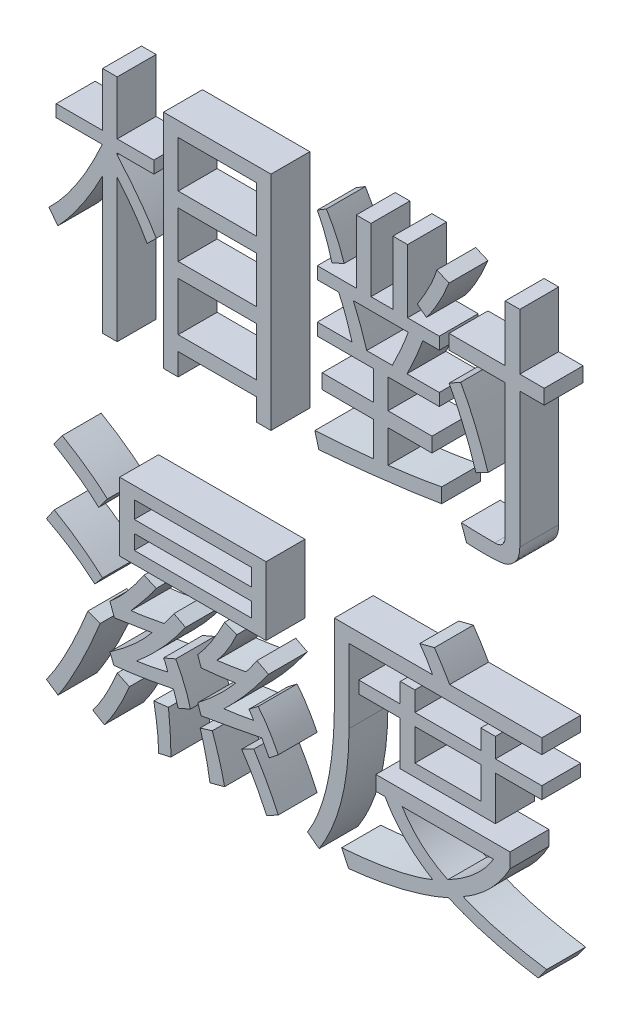
from build123d import *

# Parameters (mm, degrees)
EXTRUDE_1_DEPTH    = 3.5
SKETCH_2_W         = 7.024390244
SKETCH_2_H         = 4.170731708
SKETCH_2_H_2       = 4.390243903
EXTRUDE_1_2_DEPTH  = 3.5
EXTRUDE_1_3_DEPTH  = 3.5
EXTRUDE_1_4_DEPTH  = 3.5
EXTRUDE_1_5_DEPTH  = 3.5
EXTRUDE_1_6_DEPTH  = 3.5
EXTRUDE_1_7_DEPTH  = 3.5
EXTRUDE_1_8_DEPTH  = 3.5
SKETCH_2_W_2       = 13.170731708
SKETCH_2_H_3       = 6.146341463
SKETCH_2_W_3       = 10.536585366
SKETCH_2_H_4       = 1.536585365
SKETCH_2_H_5       = 1.317073171
EXTRUDE_1_9_DEPTH  = 3.5
EXTRUDE_1_10_DEPTH = 3.5
EXTRUDE_1_11_DEPTH = 3.5
EXTRUDE_1_12_DEPTH = 3.5
EXTRUDE_1_13_DEPTH = 3.5
EXTRUDE_1_14_DEPTH = 3.5
EXTRUDE_1_15_DEPTH = 3.5
EXTRUDE_1_16_DEPTH = 3.5
EXTRUDE_1_17_DEPTH = 3.5
EXTRUDE_1_18_DEPTH = 3.5
SKETCH_2_W_4       = 5.926829268
SKETCH_2_H_6       = 2.853658537
EXTRUDE_1_19_DEPTH = 3.5
EXTRUDE_1_20_DEPTH = 3.5


with BuildPart() as part:
    # 草圖2 → 填料-伸長1 (new body)
    with BuildSketch(Plane.XY):
        with BuildLine():
            Line((11.195121951, 8.492378049), (10.37195122, 7.682926829))
            add(Edge.make_bspline(
                [(10.37195122, 7.682926829), (10.194001007, 7.995110736), (9.828654537, 8.636050058), (9.192617307, 9.575460859), (8.478376217, 10.530055372), (7.952666495, 11.150939105), (7.682926829, 11.469512195)],
                knots=[0, 0, 0, 0, 0.926494149, 1.902168946, 2.923610835, 4, 4, 4, 4], degree=3))
            Line((7.682926829, 11.469512195), (7.682926829, -1.317073171))
            Line((7.682926829, -1.317073171), (6.365853659, -1.317073171))
            Line((6.365853659, -1.317073171), (6.365853659, 10.955030488))
            add(Edge.make_bspline(
                [(6.365853659, 10.955030488), (6.215695345, 10.664757037), (5.919445146, 10.092071011), (5.448191947, 9.262177755), (4.965376822, 8.468777478), (4.466566618, 7.714189973), (3.959301962, 6.9922869), (3.439571365, 6.306551586), (2.903589275, 5.659115278), (2.530613952, 5.250831327), (2.346036585, 5.048780488)],
                knots=[0, 0, 0, 0, 1.09419143, 2.15875114, 3.194770078, 4.203431801, 5.186928088, 6.148575884, 7.083770513, 8, 8, 8, 8], degree=3))
            Line((2.346036585, 5.048780488), (1.536585366, 6.091463415))
            add(Edge.make_bspline(
                [(1.536585366, 6.091463415), (1.759917396, 6.316467103), (2.215687975, 6.775649163), (2.861543167, 7.525851201), (3.491437342, 8.340136735), (4.094833622, 9.224938723), (4.691759287, 10.168014651), (5.261391283, 11.182375763), (5.819159698, 12.259265922), (6.165245336, 13.008121113), (6.341844512, 13.390243902)],
                knots=[0, 0, 0, 0, 0.865432811, 1.76615425, 2.700926786, 3.675112701, 4.689371464, 5.747644892, 6.850677372, 8, 8, 8, 8], degree=3))
            Line((6.341844512, 13.390243902), (2.195121951, 13.390243902))
            Line((2.195121951, 13.390243902), (2.195121951, 14.487804878))
            Line((2.195121951, 14.487804878), (6.365853659, 14.487804878))
            Line((6.365853659, 14.487804878), (6.365853659, 19.317073171))
            Line((6.365853659, 19.317073171), (7.682926829, 19.317073171))
            Line((7.682926829, 19.317073171), (7.682926829, 14.487804878))
            Line((7.682926829, 14.487804878), (10.975609756, 14.487804878))
            Line((10.975609756, 14.487804878), (10.975609756, 13.390243902))
            Line((10.975609756, 13.390243902), (7.682926829, 13.390243902))
            Line((7.682926829, 13.390243902), (7.682926829, 13.225609756))
            add(Edge.make_bspline(
                [(7.682926829, 13.225609756), (7.867915933, 13.013746523), (8.230737255, 12.598216651), (8.749747103, 11.972489826), (9.234615126, 11.358953316), (9.694165494, 10.763026288), (10.1136308, 10.175919212), (10.507113856, 9.605772744), (10.868089211, 9.048616748), (11.087786379, 8.674941418), (11.195121951, 8.492378049)],
                knots=[0, 0, 0, 0, 1.143459145, 2.242679984, 3.304712972, 4.322704541, 5.301803685, 6.237830081, 7.139071671, 8, 8, 8, 8], degree=3))
        make_face()
    extrude(amount=EXTRUDE_1_DEPTH)


with BuildPart() as body_2:
    # 草圖2 → Extrude 1 2 (new body)
    with BuildSketch(Plane.XY):
        Polygon((21.512195122, -1.317073171), (20.195121951, -1.317073171), (20.195121951, 0.658536585), (13.170731707, 0.658536585), (13.170731707, -1.317073171), (11.853658537, -1.317073171), (11.853658537, 18.658536585), (21.512195122, 18.658536585), align=None)
        with Locations((16.682926829, 15.256097561)):
            Rectangle(SKETCH_2_W, SKETCH_2_H, mode=Mode.SUBTRACT)
        with Locations((16.682926829, 9.768292683)):
            Rectangle(SKETCH_2_W, SKETCH_2_H, mode=Mode.SUBTRACT)
        with Locations((16.682926829, 4.170731708)):
            Rectangle(SKETCH_2_W, SKETCH_2_H_2, mode=Mode.SUBTRACT)
    extrude(amount=EXTRUDE_1_2_DEPTH)


with BuildPart() as body_3:
    # 草圖2 → Extrude 1 3 (new body)
    with BuildSketch(Plane.XY):
        with BuildLine():
            add(Edge.make_bspline(
                [(36.87804878, 0.658536585), (36.479239613, 0.592109643), (35.664311248, 0.456372544), (34.413150927, 0.272757679), (33.109447277, 0.098721548), (31.753467888, -0.069606956), (30.344788428, -0.230068855), (28.883781703, -0.384994037), (27.370008335, -0.529462451), (26.342700315, -0.615016395), (25.820121951, -0.658536585)],
                knots=[0, 0, 0, 0, 0.871065814, 1.779939626, 2.724368522, 3.704811522, 4.72380686, 5.778991205, 6.870201418, 8, 8, 8, 8], degree=3))
            Line((25.820121951, -0.658536585), (25.463414634, 0.658536585))
            add(Edge.make_bspline(
                [(25.463414634, 0.658536585), (25.870473505, 0.684110794), (26.706615328, 0.736642914), (27.992053677, 0.831510617), (29.340832205, 0.953832667), (30.260731458, 1.044355014), (30.731707317, 1.09070122)],
                knots=[0, 0, 0, 0, 0.92583437, 1.90176137, 2.925730468, 4, 4, 4, 4], degree=3))
            Line((30.731707317, 1.09070122), (30.731707317, 4.170731707))
            Line((30.731707317, 4.170731707), (26.12195122, 4.170731707))
            Line((26.12195122, 4.170731707), (26.12195122, 5.487804878))
            Line((26.12195122, 5.487804878), (30.731707317, 5.487804878))
            Line((30.731707317, 5.487804878), (30.731707317, 8.12195122))
            Line((30.731707317, 8.12195122), (25.682926829, 8.12195122))
            Line((25.682926829, 8.12195122), (25.682926829, 9.219512195))
            Line((25.682926829, 9.219512195), (28.81097561, 9.219512195))
            add(Edge.make_bspline(
                [(28.81097561, 9.219512195), (28.722233505, 9.522215625), (28.549049417, 10.112954568), (28.250347401, 10.962153868), (27.946901845, 11.761759944), (27.716095311, 12.266373839), (27.603658537, 12.512195122)],
                knots=[0, 0, 0, 0, 1.078020835, 2.10380467, 3.076273615, 4, 4, 4, 4], degree=3))
            Line((27.603658537, 12.512195122), (25.682926829, 12.512195122))
            Line((25.682926829, 12.512195122), (25.682926829, 13.609756098))
            Line((25.682926829, 13.609756098), (29.195121951, 13.609756098))
            Line((29.195121951, 13.609756098), (29.195121951, 19.317073171))
            Line((29.195121951, 19.317073171), (30.512195122, 19.317073171))
            Line((30.512195122, 19.317073171), (30.512195122, 13.609756098))
            Line((30.512195122, 13.609756098), (32.487804878, 13.609756098))
            Line((32.487804878, 13.609756098), (32.487804878, 19.317073171))
            Line((32.487804878, 19.317073171), (33.804878049, 19.317073171))
            Line((33.804878049, 19.317073171), (33.804878049, 13.609756098))
            Line((33.804878049, 13.609756098), (36.658536585, 13.609756098))
            Line((36.658536585, 13.609756098), (36.658536585, 12.512195122))
            Line((36.658536585, 12.512195122), (35.176829268, 12.512195122))
            add(Edge.make_bspline(
                [(35.176829268, 12.512195122), (35.072202937, 12.23256672), (34.863030097, 11.673523249), (34.518148298, 10.845603445), (34.149237498, 10.026346651), (33.883122969, 9.488545537), (33.75, 9.219512195)],
                knots=[0, 0, 0, 0, 0.997752604, 1.994744001, 2.996876897, 4, 4, 4, 4], degree=3))
            Line((33.75, 9.219512195), (36.658536585, 9.219512195))
            Line((36.658536585, 9.219512195), (36.658536585, 8.12195122))
            Line((36.658536585, 8.12195122), (32.048780488, 8.12195122))
            Line((32.048780488, 8.12195122), (32.048780488, 5.487804878))
            Line((32.048780488, 5.487804878), (36, 5.487804878))
            Line((36, 5.487804878), (36, 4.170731707))
            Line((36, 4.170731707), (32.048780488, 4.170731707))
            Line((32.048780488, 4.170731707), (32.048780488, 1.245045732))
            add(Edge.make_bspline(
                [(32.048780488, 1.245045732), (32.433165458, 1.288913096), (33.215646696, 1.378212605), (34.404286369, 1.549722353), (35.631027102, 1.742115455), (36.457681907, 1.896899601), (36.87804878, 1.975609756)],
                knots=[0, 0, 0, 0, 0.950226922, 1.934349145, 2.949584292, 4, 4, 4, 4], degree=3))
            Line((36.87804878, 1.975609756), (36.87804878, 0.658536585))
        make_face()
        with BuildLine():
            Line((33.859756098, 12.512195122), (28.920731707, 12.512195122))
            add(Edge.make_bspline(
                [(28.920731707, 12.512195122), (29.028453625, 12.258959869), (29.247963514, 11.742930785), (29.557869177, 10.940732841), (29.850643317, 10.095390577), (30.034489589, 9.514915436), (30.12804878, 9.219512195)],
                knots=[0, 0, 0, 0, 0.941091742, 1.917705787, 2.940322478, 4, 4, 4, 4], degree=3))
            Line((30.12804878, 9.219512195), (32.432926829, 9.219512195))
            add(Edge.make_bspline(
                [(32.432926829, 9.219512195), (32.584264269, 9.52974749), (32.873128727, 10.121907307), (33.262226073, 10.981368871), (33.590573188, 11.767604059), (33.773533973, 12.273694753), (33.859756098, 12.512195122)],
                knots=[0, 0, 0, 0, 1.153513399, 2.201762002, 3.152562119, 4, 4, 4, 4], degree=3))
        make_face(mode=Mode.SUBTRACT)
    extrude(amount=EXTRUDE_1_3_DEPTH)


with BuildPart() as body_4:
    # 草圖2 → Extrude 1 4 (new body)
    with BuildSketch(Plane.XY):
        with BuildLine():
            Line((46.097560976, 12.951219512), (43.902439024, 12.951219512))
            Line((43.902439024, 12.951219512), (43.902439024, 0.795731707))
            add(Edge.make_bspline(
                [(43.902439024, 0.795731707), (43.89874847, 0.663798036), (43.891715468, 0.412375126), (43.813850742, 0.057097246), (43.692685574, -0.257432277), (43.516873076, -0.522584136), (43.315622187, -0.744710865), (43.096501316, -0.924349749), (42.868006095, -1.069918931), (42.658115071, -1.154666328), (42.470236451, -1.204835945), (42.298050304, -1.234793709), (42.093866371, -1.256397329), (41.858680139, -1.282303045), (41.590878487, -1.298316512), (41.291212997, -1.307597972), (40.959633148, -1.314612526), (40.727518967, -1.31622911), (40.60632622, -1.317073171)],
                knots=[0, 0, 0, 0, 1.393959343, 2.656435708, 3.829226923, 4.940030392, 6.002126219, 6.990473935, 7.930543058, 8.858465568, 9.372067435, 9.986739113, 10.705586259, 11.54470175, 12.490360102, 13.543598056, 14.717449747, 16, 16, 16, 16], degree=3))
            add(Edge.make_bspline(
                [(40.60632622, -1.317073171), (40.346680538, -1.315475135), (39.846411552, -1.312396141), (39.347459424, -1.276183219), (39.107469512, -1.258765244)],
                knots=[0, 0, 0, 0, 1.038024297, 2, 2, 2, 2], degree=3))
            Line((39.107469512, -1.258765244), (38.634146341, 0.068597561))
            add(Edge.make_bspline(
                [(38.634146341, 0.068597561), (38.846761388, 0.057371155), (39.29696043, 0.033599945), (40.011742263, 0.015883439), (40.801762821, 0.000619343), (41.354029714, 0.000212337), (41.64214939, 0)],
                knots=[0, 0, 0, 0, 0.849009304, 1.797724023, 2.851064495, 4, 4, 4, 4], degree=3))
            add(Edge.make_bspline(
                [(41.64214939, 0), (41.715719876, 0.001550386), (41.855516521, 0.004496388), (42.049685822, 0.055650379), (42.220232086, 0.127261484), (42.353482251, 0.243273481), (42.459665489, 0.384276048), (42.535865329, 0.557498863), (42.579177844, 0.761595121), (42.583232144, 0.907557455), (42.585365854, 0.984375)],
                knots=[0, 0, 0, 0, 1.126045964, 2.139682047, 3.066887442, 3.939260296, 4.817270513, 5.760467651, 6.821371433, 8, 8, 8, 8], degree=3))
            Line((42.585365854, 0.984375), (42.585365854, 12.951219512))
            Line((42.585365854, 12.951219512), (37.536585366, 12.951219512))
            Line((37.536585366, 12.951219512), (37.536585366, 14.268292683))
            Line((37.536585366, 14.268292683), (42.585365854, 14.268292683))
            Line((42.585365854, 14.268292683), (42.585365854, 19.317073171))
            Line((42.585365854, 19.317073171), (43.902439024, 19.317073171))
            Line((43.902439024, 19.317073171), (43.902439024, 14.268292683))
            Line((43.902439024, 14.268292683), (46.097560976, 14.268292683))
            Line((46.097560976, 14.268292683), (46.097560976, 12.951219512))
        make_face()
    extrude(amount=EXTRUDE_1_4_DEPTH)


with BuildPart() as body_5:
    # 草圖2 → Extrude 1 5 (new body)
    with BuildSketch(Plane.XY):
        with BuildLine():
            add(Edge.make_bspline(
                [(37.536585366, 18.181783537), (37.393225684, 17.841483376), (37.111468153, 17.172661207), (36.624266309, 16.216216026), (36.097284623, 15.318753538), (35.701054348, 14.761828266), (35.506097561, 14.487804878)],
                knots=[0, 0, 0, 0, 1.048181086, 2.060083505, 3.045504817, 4, 4, 4, 4], degree=3))
            Line((35.506097561, 14.487804878), (34.682926829, 15.115472561))
            add(Edge.make_bspline(
                [(34.682926829, 15.115472561), (34.790381826, 15.285131256), (34.999827137, 15.615820563), (35.286869763, 16.110202132), (35.546893211, 16.584587488), (35.786635769, 17.034315201), (35.987126618, 17.469388445), (36.167523279, 17.88093305), (36.320356596, 18.273769925), (36.400440084, 18.533431415), (36.43902439, 18.658536585)],
                knots=[0, 0, 0, 0, 1.215130635, 2.368465142, 3.458389289, 4.488834968, 5.451365271, 6.356147849, 7.20799036, 8, 8, 8, 8], degree=3))
            Line((36.43902439, 18.658536585), (37.536585366, 18.181783537))
        make_face()
    extrude(amount=EXTRUDE_1_5_DEPTH)


with BuildPart() as body_6:
    # 草圖2 → Extrude 1 6 (new body)
    with BuildSketch(Plane.XY):
        with BuildLine():
            Line((28.097560976, 14.985137195), (27, 14.487804878))
            add(Edge.make_bspline(
                [(27, 14.487804878), (26.917764724, 14.788419731), (26.753744958, 15.388001574), (26.446077837, 16.264685579), (26.094883421, 17.119219593), (25.820136532, 17.66775252), (25.682926829, 17.941692073)],
                knots=[0, 0, 0, 0, 1.009354514, 2.013176112, 3.007772146, 4, 4, 4, 4], degree=3))
            Line((25.682926829, 17.941692073), (26.506097561, 18.43902439))
            add(Edge.make_bspline(
                [(26.506097561, 18.43902439), (26.66597493, 18.169879825), (26.987265848, 17.629004623), (27.412106667, 16.780899391), (27.783062226, 15.89720013), (27.992270199, 15.29048599), (28.097560976, 14.985137195)],
                knots=[0, 0, 0, 0, 0.985279188, 1.980025419, 2.983381524, 4, 4, 4, 4], degree=3))
        make_face()
    extrude(amount=EXTRUDE_1_6_DEPTH)


with BuildPart() as body_7:
    # 草圖2 → Extrude 1 7 (new body)
    with BuildSketch(Plane.XY):
        with BuildLine():
            Line((41.048780488, 5.179115854), (39.951219512, 4.609756098))
            add(Edge.make_bspline(
                [(39.951219512, 4.609756098), (39.799297043, 5.094275082), (39.49277485, 6.071851493), (38.920236977, 7.514672907), (38.282417195, 8.962844479), (37.786865716, 9.905931038), (37.536585366, 10.382240854)],
                knots=[0, 0, 0, 0, 0.971873337, 1.960873523, 2.970130635, 4, 4, 4, 4], degree=3))
            Line((37.536585366, 10.382240854), (38.579268293, 10.975609756))
            add(Edge.make_bspline(
                [(38.579268293, 10.975609756), (38.686623969, 10.781809619), (38.907212814, 10.383599204), (39.226462107, 9.760176378), (39.535346156, 9.093066827), (39.851476299, 8.390140547), (40.151182545, 7.642392048), (40.461226187, 6.859530137), (40.756023754, 6.032828235), (40.949912666, 5.467425818), (41.048780488, 5.179115854)],
                knots=[0, 0, 0, 0, 0.842606769, 1.73134444, 2.663122562, 3.638416779, 4.662315381, 5.726598791, 6.840747397, 8, 8, 8, 8], degree=3))
        make_face()
    extrude(amount=EXTRUDE_1_7_DEPTH)


with BuildPart() as body_8:
    # 草圖2 → Extrude 1 8 (new body)
    with BuildSketch(Plane.XY):
        with BuildLine():
            Line((6.804878049, -14.006097561), (6.016006098, -15.048780488))
            add(Edge.make_bspline(
                [(6.016006098, -15.048780488), (5.895685002, -14.936910658), (5.645839613, -14.704614225), (5.240864995, -14.363749041), (4.796502529, -14.013374166), (4.313142114, -13.651959296), (3.784045473, -13.287983824), (3.219093738, -12.910187991), (2.613155357, -12.524526019), (2.192245081, -12.270821356), (1.975609756, -12.140243902)],
                knots=[0, 0, 0, 0, 0.790397559, 1.641251557, 2.545903749, 3.512977392, 4.544534932, 5.635403711, 6.782982706, 8, 8, 8, 8], degree=3))
            Line((1.975609756, -12.140243902), (2.740472561, -11.097560976))
            add(Edge.make_bspline(
                [(2.740472561, -11.097560976), (3.131847794, -11.331200457), (3.891441595, -11.784655571), (4.954330216, -12.513844259), (5.928662336, -13.23811268), (6.518751932, -13.75531396), (6.804878049, -14.006097561)],
                knots=[0, 0, 0, 0, 1.09226414, 2.11990182, 3.088366926, 4, 4, 4, 4], degree=3))
        make_face()
    extrude(amount=EXTRUDE_1_8_DEPTH)


with BuildPart() as body_9:
    # 草圖2 → Extrude 1 9 (new body)
    with BuildSketch(Plane.XY):
        with Locations((14.487804878, -14.829268293)):
            Rectangle(SKETCH_2_W_2, SKETCH_2_H_3)
        with Locations((14.487804878, -13.62195122)):
            Rectangle(SKETCH_2_W_3, SKETCH_2_H_4, mode=Mode.SUBTRACT)
        with Locations((14.487804878, -16.146341464)):
            Rectangle(SKETCH_2_W_3, SKETCH_2_H_5, mode=Mode.SUBTRACT)
    extrude(amount=EXTRUDE_1_9_DEPTH)


with BuildPart() as body_10:
    # 草圖2 → Extrude 1 10 (new body)
    with BuildSketch(Plane.XY):
        with BuildLine():
            Line((6.365853659, -20.37195122), (5.669588415, -21.195121951))
            add(Edge.make_bspline(
                [(5.669588415, -21.195121951), (5.34266575, -20.921971199), (4.683540255, -20.371258002), (3.622555842, -19.621086691), (2.502574085, -18.914688921), (1.715503577, -18.497682254), (1.317073171, -18.286585366)],
                knots=[0, 0, 0, 0, 0.973940654, 1.963611541, 2.969140539, 4, 4, 4, 4], degree=3))
            Line((1.317073171, -18.286585366), (2.023628049, -17.243902439))
            add(Edge.make_bspline(
                [(2.023628049, -17.243902439), (2.410462708, -17.472874497), (3.181893601, -17.929493663), (4.28872953, -18.689142947), (5.356685602, -19.495819145), (6.029494972, -20.079933818), (6.365853659, -20.37195122)],
                knots=[0, 0, 0, 0, 1.005963703, 2.006106376, 3.003189505, 4, 4, 4, 4], degree=3))
        make_face()
    extrude(amount=EXTRUDE_1_10_DEPTH)


with BuildPart() as body_11:
    # 草圖2 → Extrude 1 11 (new body)
    with BuildSketch(Plane.XY):
        with BuildLine():
            Line((14.268292683, -26.645198171), (13.170731707, -27.12195122))
            add(Edge.make_bspline(
                [(13.170731707, -27.12195122), (13.130175931, -26.986851776), (13.054378028, -26.734353728), (12.939942123, -26.38525642), (12.842780112, -26.089017729), (12.775703918, -25.912151551), (12.745426829, -25.832317073)],
                knots=[0, 0, 0, 0, 1.246138474, 2.329006878, 3.245741243, 4, 4, 4, 4], degree=3))
            add(Edge.make_bspline(
                [(12.745426829, -25.832317073), (12.289780384, -25.925467503), (11.386429348, -26.110144763), (10.034523774, -26.335028498), (8.703276932, -26.536368529), (7.819350368, -26.634348257), (7.381097561, -26.682926829)],
                knots=[0, 0, 0, 0, 1.027005234, 2.036109911, 3.026298815, 4, 4, 4, 4], degree=3))
            Line((7.381097561, -26.682926829), (7.024390244, -25.804878049))
            add(Edge.make_bspline(
                [(7.024390244, -25.804878049), (7.223226392, -25.665689168), (7.613907099, -25.392205644), (8.170650634, -24.965535427), (8.698556491, -24.543428761), (9.191350708, -24.119939771), (9.648737467, -23.693937638), (10.070676626, -23.267068993), (10.46399082, -22.845044627), (10.70162726, -22.55240456), (10.817835366, -22.40929878)],
                knots=[0, 0, 0, 0, 1.140042612, 2.239998397, 3.294336047, 4.314948586, 5.291554596, 6.229593053, 7.134242047, 8, 8, 8, 8], degree=3))
            Line((10.817835366, -22.40929878), (7.429115854, -22.951219512))
            Line((7.429115854, -22.951219512), (7.024390244, -21.853658537))
            add(Edge.make_bspline(
                [(7.024390244, -21.853658537), (7.152313597, -21.745052012), (7.414656721, -21.522323523), (7.79783094, -21.157989708), (8.180891497, -20.759640102), (8.566276423, -20.330305797), (8.948983289, -19.866741708), (9.334215912, -19.372162714), (9.718438798, -18.842790687), (9.969310834, -18.474739516), (10.097560976, -18.286585366)],
                knots=[0, 0, 0, 0, 0.852319151, 1.74792221, 2.684397488, 3.659152232, 4.677899211, 5.737400043, 6.843319611, 8, 8, 8, 8], degree=3))
            Line((10.097560976, -18.286585366), (11.195121951, -18.773628049))
            add(Edge.make_bspline(
                [(11.195121951, -18.773628049), (11.159096052, -18.832302304), (11.074933034, -18.969375978), (10.913801312, -19.195690905), (10.706272595, -19.47515602), (10.446004087, -19.804440347), (10.142346905, -20.189661197), (9.783284628, -20.623586416), (9.381307352, -21.115020226), (9.090981676, -21.455201443), (8.938262195, -21.634146341)],
                knots=[0, 0, 0, 0, 0.453096944, 1.058516412, 1.827631533, 2.744419089, 3.820990896, 5.056301648, 6.451531779, 8, 8, 8, 8], degree=3))
            add(Edge.make_bspline(
                [(8.938262195, -21.634146341), (9.017181851, -21.627647173), (9.187833605, -21.613593709), (9.462494439, -21.58275179), (9.775404808, -21.536325971), (10.127633629, -21.4819738), (10.518611773, -21.416477587), (10.947298697, -21.340698056), (11.415245567, -21.255496404), (11.739420585, -21.191026189), (11.908536585, -21.157393293)],
                knots=[0, 0, 0, 0, 0.631425652, 1.365361961, 2.20340383, 3.153685227, 4.207324198, 5.364426221, 6.625070808, 8, 8, 8, 8], degree=3))
            add(Edge.make_bspline(
                [(11.908536585, -21.157393293), (11.997958516, -21.038673594), (12.167589286, -20.813465819), (12.403528526, -20.492473664), (12.607394408, -20.20683532), (12.729715531, -20.026881181), (12.786585366, -19.943216463)],
                knots=[0, 0, 0, 0, 1.19014648, 2.257672853, 3.189953014, 4, 4, 4, 4], degree=3))
            Line((12.786585366, -19.943216463), (13.829268293, -20.498856707))
            add(Edge.make_bspline(
                [(13.829268293, -20.498856707), (13.674409408, -20.718534256), (13.364576764, -21.158052312), (12.867406481, -21.794393447), (12.353846024, -22.421842479), (11.810628715, -23.029815793), (11.248344837, -23.629558301), (10.658591051, -24.210049026), (10.047660476, -24.77859228), (9.624343477, -25.142031459), (9.411585366, -25.324695122)],
                knots=[0, 0, 0, 0, 0.982953296, 1.966635754, 2.952910358, 3.948221883, 4.94812618, 5.95943845, 6.974418644, 8, 8, 8, 8], degree=3))
            add(Edge.make_bspline(
                [(9.411585366, -25.324695122), (9.56707735, -25.29957108), (9.867854461, -25.250972198), (10.302726179, -25.180234696), (10.705198944, -25.108095674), (11.073113997, -25.035951746), (11.408554335, -24.968140028), (11.708849342, -24.898800028), (11.978260513, -24.835123564), (12.14533923, -24.787887775), (12.224085366, -24.765625)],
                knots=[0, 0, 0, 0, 1.317536546, 2.54858691, 3.685391053, 4.737587821, 5.68475564, 6.547800657, 7.315561622, 8, 8, 8, 8], degree=3))
            add(Edge.make_bspline(
                [(12.224085366, -24.765625), (12.193572644, -24.671776705), (12.136336043, -24.495733499), (12.05040038, -24.249174772), (11.953115726, -24.043551291), (11.885080603, -23.920430494), (11.853658537, -23.863567073)],
                knots=[0, 0, 0, 0, 1.211754691, 2.273042671, 3.202403625, 4, 4, 4, 4], degree=3))
            Line((11.853658537, -23.863567073), (12.951219512, -23.390243902))
            add(Edge.make_bspline(
                [(12.951219512, -23.390243902), (13.091283222, -23.647802112), (13.371063731, -24.16228061), (13.718693732, -24.969343605), (14.031742022, -25.793174796), (14.189182344, -26.360253466), (14.268292683, -26.645198171)],
                knots=[0, 0, 0, 0, 0.998776884, 1.99507999, 2.992571276, 4, 4, 4, 4], degree=3))
        make_face()
    extrude(amount=EXTRUDE_1_11_DEPTH)


with BuildPart() as body_12:
    # 草圖2 → Extrude 1 12 (new body)
    with BuildSketch(Plane.XY):
        with BuildLine():
            Line((22.170731707, -26.254192073), (21.347560976, -26.902439024))
            Line((21.347560976, -26.902439024), (20.68902439, -25.674542683))
            add(Edge.make_bspline(
                [(20.68902439, -25.674542683), (20.391891489, -25.733492164), (19.817407046, -25.847466617), (18.984030877, -26.001995168), (18.212273827, -26.153099485), (17.499003518, -26.280362285), (16.846749556, -26.402352363), (16.253324972, -26.508425758), (15.719427044, -26.601212096), (15.383037243, -26.65683349), (15.225228659, -26.682926829)],
                knots=[0, 0, 0, 0, 1.308450527, 2.52979212, 3.661039907, 4.705226898, 5.659308597, 6.527258405, 7.309101332, 8, 8, 8, 8], degree=3))
            Line((15.225228659, -26.682926829), (14.937118902, -25.804878049))
            add(Edge.make_bspline(
                [(14.937118902, -25.804878049), (15.250163932, -25.559463233), (15.872295357, -25.071737013), (16.744357185, -24.275884112), (17.577173779, -23.453884345), (18.085991327, -22.866602036), (18.339557927, -22.573932927)],
                knots=[0, 0, 0, 0, 1.015027455, 2.017219306, 3.011891471, 4, 4, 4, 4], degree=3))
            add(Edge.make_bspline(
                [(18.339557927, -22.573932927), (18.244660157, -22.588752856), (18.044645104, -22.619988668), (17.729695775, -22.670088159), (17.384760833, -22.711173581), (17.011390823, -22.761843025), (16.609876899, -22.808246328), (16.178925835, -22.856929713), (15.719293016, -22.904820084), (15.402459783, -22.935424932), (15.238948171, -22.951219512)],
                knots=[0, 0, 0, 0, 0.737893124, 1.55524974, 2.449670796, 3.406192835, 4.449879139, 5.554643363, 6.737997893, 8, 8, 8, 8], degree=3))
            Line((15.238948171, -22.951219512), (14.926829268, -22.073170732))
            add(Edge.make_bspline(
                [(14.926829268, -22.073170732), (15.030768115, -21.953997888), (15.242814859, -21.710872106), (15.548947135, -21.320150888), (15.85239793, -20.899668984), (16.155779398, -20.447953065), (16.455821517, -19.965886762), (16.755355303, -19.452281573), (17.052895395, -18.909088461), (17.24413463, -18.532913097), (17.341463415, -18.341463415)],
                knots=[0, 0, 0, 0, 0.851293495, 1.736732884, 2.671307665, 3.642760826, 4.665888274, 5.727994635, 6.843691672, 8, 8, 8, 8], degree=3))
            Line((17.341463415, -18.341463415), (18.43902439, -18.766768293))
            add(Edge.make_bspline(
                [(18.43902439, -18.766768293), (18.317042263, -19.031627329), (18.075716971, -19.555615438), (17.65128078, -20.300853512), (17.182349964, -21.001475439), (16.830426883, -21.433238667), (16.655487805, -21.647865854)],
                knots=[0, 0, 0, 0, 1.028686851, 2.035119074, 3.023268221, 4, 4, 4, 4], degree=3))
            add(Edge.make_bspline(
                [(16.655487805, -21.647865854), (17.076719721, -21.592790376), (17.941955873, -21.479661971), (18.800860632, -21.325618836), (19.241615854, -21.246570122)],
                knots=[0, 0, 0, 0, 0.973680804, 2, 2, 2, 2], degree=3))
            add(Edge.make_bspline(
                [(19.241615854, -21.246570122), (19.268323945, -21.219504085), (19.327539721, -21.159494688), (19.416591566, -21.049702255), (19.522012194, -20.917304199), (19.643198491, -20.759943026), (19.77137362, -20.572646757), (19.919705186, -20.364835236), (20.081457272, -20.130799207), (20.191944943, -19.965109436), (20.25, -19.87804878)],
                knots=[0, 0, 0, 0, 0.535966828, 1.188317497, 1.991580308, 2.923535453, 3.988168681, 5.191497644, 6.524289967, 8, 8, 8, 8], degree=3))
            Line((20.25, -19.87804878), (21.292682927, -20.42339939))
            add(Edge.make_bspline(
                [(21.292682927, -20.42339939), (20.988908254, -20.842409807), (20.383566758, -21.677385251), (19.410157839, -22.876435786), (18.380771116, -24.020074506), (17.655726901, -24.743640012), (17.293445122, -25.105182927)],
                knots=[0, 0, 0, 0, 1.00706062, 2.006801875, 3.004061618, 4, 4, 4, 4], degree=3))
            add(Edge.make_bspline(
                [(17.293445122, -25.105182927), (17.529109594, -25.075362256), (17.993050519, -25.016655785), (18.674158163, -24.912194234), (19.33108237, -24.804470704), (19.758574126, -24.72094391), (19.96875, -24.679878049)],
                knots=[0, 0, 0, 0, 1.051996469, 2.071013125, 3.051615621, 4, 4, 4, 4], degree=3))
            add(Edge.make_bspline(
                [(19.96875, -24.679878049), (19.935319613, -24.630898493), (19.854677472, -24.512748016), (19.755442151, -24.353999186), (19.672859417, -24.214852233), (19.616481846, -24.127012489), (19.573349547, -24.062693126), (19.546986059, -24.028120857), (19.536585366, -24.014481707)],
                knots=[0, 0, 0, 0, 1.344806216, 3.243996286, 4.244528133, 5.014139586, 5.61106697, 6, 6, 6, 6], degree=3))
            Line((19.536585366, -24.014481707), (20.359756098, -23.390243902))
            add(Edge.make_bspline(
                [(20.359756098, -23.390243902), (20.519494917, -23.586853577), (20.851682152, -23.995716148), (21.305497849, -24.67830764), (21.754041633, -25.434697473), (22.028613184, -25.974690906), (22.170731707, -26.254192073)],
                knots=[0, 0, 0, 0, 0.894550579, 1.860275952, 2.892476588, 4, 4, 4, 4], degree=3))
        make_face()
    extrude(amount=EXTRUDE_1_12_DEPTH)


with BuildPart() as body_13:
    # 草圖2 → Extrude 1 13 (new body)
    with BuildSketch(Plane.XY):
        with BuildLine():
            add(Edge.make_bspline(
                [(6.146341463, -24.038490854), (5.995846728, -24.406145271), (5.699697497, -25.129629532), (5.236898904, -26.18366434), (4.770196084, -27.189920888), (4.300153355, -28.148799675), (3.825345427, -29.059725148), (3.342703536, -29.92185882), (2.863623224, -30.739889048), (2.525270902, -31.258501078), (2.359756098, -31.512195122)],
                knots=[0, 0, 0, 0, 1.136114451, 2.235688966, 3.29189904, 4.308207463, 5.289551844, 6.229290596, 7.133806387, 8, 8, 8, 8], degree=3))
            Line((2.359756098, -31.512195122), (1.317073171, -30.805640244))
            add(Edge.make_bspline(
                [(1.317073171, -30.805640244), (1.470793025, -30.587260967), (1.789927025, -30.133889133), (2.252027074, -29.407276765), (2.710164651, -28.606895661), (3.176308303, -27.741978758), (3.640797066, -26.805400844), (4.117149819, -25.805374932), (4.582957918, -24.730405888), (4.890836154, -23.989729709), (5.048780488, -23.609756098)],
                knots=[0, 0, 0, 0, 0.788833665, 1.637678124, 2.542530736, 3.512630171, 4.539700132, 5.630474507, 6.784411886, 8, 8, 8, 8], degree=3))
            Line((5.048780488, -23.609756098), (6.146341463, -24.038490854))
        make_face()
    extrude(amount=EXTRUDE_1_13_DEPTH)


with BuildPart() as body_14:
    # 草圖2 → Extrude 1 14 (new body)
    with BuildSketch(Plane.XY):
        with BuildLine():
            Line((22.170731707, -30.946265244), (21.12804878, -31.512195122))
            add(Edge.make_bspline(
                [(21.12804878, -31.512195122), (20.94241239, -31.121970611), (20.584941287, -30.370533967), (20.019713061, -29.308247956), (19.462405146, -28.345113877), (19.067327295, -27.752354834), (18.87804878, -27.468368902)],
                knots=[0, 0, 0, 0, 1.119201725, 2.155193139, 3.116168364, 4, 4, 4, 4], degree=3))
            Line((18.87804878, -27.468368902), (19.975609756, -26.902439024))
            add(Edge.make_bspline(
                [(19.975609756, -26.902439024), (20.184648324, -27.240733634), (20.598245073, -27.910072085), (21.174190426, -28.923298811), (21.696813542, -29.933744673), (22.0139824, -30.611372198), (22.170731707, -30.946265244)],
                knots=[0, 0, 0, 0, 1.0362788, 2.050346728, 3.036453954, 4, 4, 4, 4], degree=3))
        make_face()
    extrude(amount=EXTRUDE_1_14_DEPTH)


with BuildPart() as body_15:
    # 草圖2 → Extrude 1 15 (new body)
    with BuildSketch(Plane.XY):
        with BuildLine():
            add(Edge.make_bspline(
                [(8.780487805, -27.643292683), (8.696705307, -27.841433694), (8.531225017, -28.232785499), (8.272488633, -28.805020611), (8.000176786, -29.350627601), (7.721896599, -29.873112449), (7.437832926, -30.373345002), (7.147831411, -30.851069428), (6.84435068, -31.301353254), (6.634258998, -31.589421122), (6.530487805, -31.731707317)],
                knots=[0, 0, 0, 0, 1.103479291, 2.179501406, 3.22071246, 4.230788488, 5.215694843, 6.171196475, 7.096693785, 8, 8, 8, 8], degree=3))
            Line((6.530487805, -31.731707317), (5.487804878, -31.117759146))
            add(Edge.make_bspline(
                [(5.487804878, -31.117759146), (5.582834847, -30.991769822), (5.778131931, -30.732847845), (6.054462545, -30.315402823), (6.330936578, -29.866198744), (6.611839275, -29.386332065), (6.878892614, -28.867045753), (7.151993047, -28.316897737), (7.421901383, -27.73243358), (7.594748662, -27.328180981), (7.682926829, -27.12195122)],
                knots=[0, 0, 0, 0, 0.828369581, 1.702390988, 2.626896074, 3.5977655, 4.620697854, 5.691790416, 6.822465183, 8, 8, 8, 8], degree=3))
            Line((7.682926829, -27.12195122), (8.780487805, -27.643292683))
        make_face()
    extrude(amount=EXTRUDE_1_15_DEPTH)


with BuildPart() as body_16:
    # 草圖2 → Extrude 1 16 (new body)
    with BuildSketch(Plane.XY):
        with BuildLine():
            Line((17.341463415, -31.155487805), (16.024390244, -31.512195122))
            add(Edge.make_bspline(
                [(16.024390244, -31.512195122), (15.978703951, -31.221387522), (15.883910609, -30.61799813), (15.689579886, -29.687542851), (15.441149839, -28.699997801), (15.246725845, -28.025728206), (15.146341463, -27.677591463)],
                knots=[0, 0, 0, 0, 0.897088962, 1.861347377, 2.895777647, 4, 4, 4, 4], degree=3))
            Line((15.146341463, -27.677591463), (16.243902439, -27.341463415))
            add(Edge.make_bspline(
                [(16.243902439, -27.341463415), (16.308727706, -27.527552445), (16.435641704, -27.89187494), (16.607846844, -28.429390772), (16.771415962, -28.940534279), (16.914702, -29.429357409), (17.046364559, -29.894089889), (17.157589122, -30.336262861), (17.260324013, -30.752650961), (17.314939919, -31.023805281), (17.341463415, -31.155487805)],
                knots=[0, 0, 0, 0, 1.190670151, 2.331077327, 3.410423057, 4.43342439, 5.408951324, 6.328831069, 7.188418823, 8, 8, 8, 8], degree=3))
        make_face()
    extrude(amount=EXTRUDE_1_16_DEPTH)


with BuildPart() as body_17:
    # 草圖2 → Extrude 1 17 (new body)
    with BuildSketch(Plane.XY):
        with BuildLine():
            Line((12.512195122, -31.261814024), (11.414634146, -31.512195122))
            add(Edge.make_bspline(
                [(11.414634146, -31.512195122), (11.404526048, -31.227380748), (11.383384471, -30.63167768), (11.299586511, -29.70194769), (11.159024066, -28.699385724), (11.038304156, -28.008799759), (10.975609756, -27.650152439)],
                knots=[0, 0, 0, 0, 0.878797712, 1.838048009, 2.877216847, 4, 4, 4, 4], degree=3))
            Line((10.975609756, -27.650152439), (12.292682927, -27.492378049))
            add(Edge.make_bspline(
                [(12.292682927, -27.492378049), (12.326402705, -27.829500864), (12.39217918, -28.487119371), (12.459943197, -29.452422934), (12.503745479, -30.371922347), (12.509426476, -30.970228289), (12.512195122, -31.261814024)],
                knots=[0, 0, 0, 0, 1.076240785, 2.099400651, 3.073738666, 4, 4, 4, 4], degree=3))
        make_face()
    extrude(amount=EXTRUDE_1_17_DEPTH)


with BuildPart() as body_18:
    # 草圖2 → Extrude 1 18 (new body)
    with BuildSketch(Plane.XY):
        with BuildLine():
            Line((45.87804878, -14.390243902), (28.536585366, -14.390243902))
            Line((28.536585366, -14.390243902), (28.536585366, -21.030487805))
            add(Edge.make_bspline(
                [(28.536585366, -21.030487805), (28.534543782, -21.298039914), (28.530511577, -21.826465405), (28.500424031, -22.610124807), (28.443087202, -23.374915278), (28.374386089, -24.123529716), (28.275399292, -24.853770188), (28.16507166, -25.56835371), (28.027014288, -26.263601493), (27.86872498, -26.941851062), (27.691184124, -27.602171432), (27.493039275, -28.245926096), (27.267847576, -28.86901979), (27.030161302, -29.478517205), (26.763778437, -30.067019524), (26.483849344, -30.642080787), (26.179620382, -31.197439877), (25.957807258, -31.554326408), (25.847560976, -31.731707317)],
                knots=[0, 0, 0, 0, 1.148325744, 2.26798659, 3.365054226, 4.439725844, 5.493902812, 6.527318512, 7.542587444, 8.535264306, 9.516081912, 10.476808831, 11.425124757, 12.359113687, 13.283827267, 14.196748223, 15.103741917, 16, 16, 16, 16], degree=3))
            Line((25.847560976, -31.731707317), (24.804878049, -30.946265244))
            add(Edge.make_bspline(
                [(24.804878049, -30.946265244), (24.903886219, -30.780369507), (25.105118121, -30.443190114), (25.375843621, -29.912754797), (25.63187461, -29.357004831), (25.867548132, -28.775546619), (26.083118671, -28.166191733), (26.283139119, -27.531797597), (26.459205579, -26.869581227), (26.62230459, -26.182749289), (26.760529221, -25.469377526), (26.885791958, -24.730955622), (26.986639941, -23.965321761), (27.073776869, -23.173003955), (27.136860509, -22.353868076), (27.186129282, -21.508889612), (27.212793281, -20.63736759), (27.217249845, -20.047272095), (27.219512195, -19.747713415)],
                knots=[0, 0, 0, 0, 0.799538782, 1.625044783, 2.463633506, 3.331930801, 4.221090951, 5.138652757, 6.084627713, 7.056943804, 8.060278045, 9.091964495, 10.15685417, 11.256481478, 12.391154884, 13.557272111, 14.759962836, 16, 16, 16, 16], degree=3))
            Line((27.219512195, -19.747713415), (27.219512195, -13.073170732))
            Line((27.219512195, -13.073170732), (36.054878049, -13.073170732))
            add(Edge.make_bspline(
                [(36.054878049, -13.073170732), (35.880115694, -12.745259007), (35.536461363, -12.100450324), (35.111359241, -11.506217723), (34.902439024, -11.214176829)],
                knots=[0, 0, 0, 0, 1.017082223, 2, 2, 2, 2], degree=3))
            Line((34.902439024, -11.214176829), (36.219512195, -10.87804878))
            add(Edge.make_bspline(
                [(36.219512195, -10.87804878), (36.353521997, -11.071489714), (36.614331721, -11.447964238), (36.971111777, -12.011316793), (37.301755569, -12.545428139), (37.496862498, -12.900842182), (37.591463415, -13.073170732)],
                knots=[0, 0, 0, 0, 1.090206407, 2.121758468, 3.089302616, 4, 4, 4, 4], degree=3))
            Line((37.591463415, -13.073170732), (45.87804878, -13.073170732))
            Line((45.87804878, -13.073170732), (45.87804878, -14.390243902))
        make_face()
    extrude(amount=EXTRUDE_1_18_DEPTH)


with BuildPart() as body_19:
    # 草圖2 → Extrude 1 19 (new body)
    with BuildSketch(Plane.XY):
        Polygon((45.87804878, -17.902439024), (41.707317073, -17.902439024), (41.707317073, -21.853658537), (33.146341463, -21.853658537), (33.146341463, -17.902439024), (29.414634146, -17.902439024), (29.414634146, -16.804878049), (33.146341463, -16.804878049), (33.146341463, -15.048780488), (34.463414634, -15.048780488), (34.463414634, -16.804878049), (40.390243902, -16.804878049), (40.390243902, -15.048780488), (41.707317073, -15.048780488), (41.707317073, -16.804878049), (45.87804878, -16.804878049), align=None)
        with Locations((37.426829268, -19.329268293)):
            Rectangle(SKETCH_2_W_4, SKETCH_2_H_6, mode=Mode.SUBTRACT)
    extrude(amount=EXTRUDE_1_19_DEPTH)


with BuildPart() as body_20:
    # 草圖2 → Extrude 1 20 (new body)
    with BuildSketch(Plane.XY):
        with BuildLine():
            Line((46.317073171, -30.908536585), (45.552210366, -31.951219512))
            add(Edge.make_bspline(
                [(45.552210366, -31.951219512), (45.151660547, -31.884839238), (44.368188973, -31.755000062), (43.223644607, -31.526816498), (42.133285061, -31.281425278), (41.096911132, -31.014004526), (40.115767939, -30.72798833), (39.191637334, -30.416427905), (38.317623448, -30.096171862), (37.762933849, -29.851565733), (37.491996951, -29.732088415)],
                knots=[0, 0, 0, 0, 1.162184872, 2.273222379, 3.340311393, 4.361127026, 5.336680946, 6.265028051, 7.152556821, 8, 8, 8, 8], degree=3))
            add(Edge.make_bspline(
                [(37.491996951, -29.732088415), (37.176687407, -29.869276343), (36.536621654, -30.147762346), (35.534193472, -30.508022637), (34.484783846, -30.837066462), (33.384026563, -31.132499157), (32.232596241, -31.391330555), (31.030536277, -31.618318084), (29.778707478, -31.806750661), (28.925650472, -31.902529908), (28.491996951, -31.951219512)],
                knots=[0, 0, 0, 0, 0.886387415, 1.799330969, 2.744702464, 3.721465897, 4.7369433, 5.786852254, 6.874941176, 8, 8, 8, 8], degree=3))
            Line((28.491996951, -31.951219512), (27.87804878, -30.634146341))
            add(Edge.make_bspline(
                [(27.87804878, -30.634146341), (28.303604523, -30.600188955), (29.130672236, -30.534192764), (30.333507149, -30.39442276), (31.465380273, -30.23640841), (32.525606012, -30.047254703), (33.515987218, -29.836387039), (34.434335551, -29.597830166), (35.282194177, -29.332390149), (35.814652709, -29.125525702), (36.072027439, -29.025533537)],
                knots=[0, 0, 0, 0, 1.222196013, 2.375338318, 3.4664561, 4.493829593, 5.458162206, 6.364860153, 7.209621685, 8, 8, 8, 8], degree=3))
            add(Edge.make_bspline(
                [(36.072027439, -29.025533537), (35.843510225, -28.884684886), (35.390637626, -28.605552765), (34.754690067, -28.134225534), (34.151572639, -27.643241517), (33.594704133, -27.114725482), (33.076449725, -26.559581082), (32.596945101, -25.974279085), (32.160190815, -25.357486353), (31.903008092, -24.924069924), (31.774390244, -24.707317073)],
                knots=[0, 0, 0, 0, 1.045222006, 2.071408091, 3.080726779, 4.073121226, 5.059421033, 6.037400383, 7.018498066, 8, 8, 8, 8], degree=3))
            Line((31.774390244, -24.707317073), (30.951219512, -24.707317073))
            Line((30.951219512, -24.707317073), (30.951219512, -23.390243902))
            Line((30.951219512, -23.390243902), (43.024390244, -23.390243902))
            Line((43.024390244, -23.390243902), (43.024390244, -24.707317073))
            add(Edge.make_bspline(
                [(43.024390244, -24.707317073), (42.900916941, -24.927795698), (42.655591378, -25.365858355), (42.227671099, -25.983973486), (41.767031108, -26.573475607), (41.254844864, -27.122103439), (40.706196147, -27.642880812), (40.110607231, -28.125309094), (39.475985792, -28.57784272), (39.025992303, -28.84569865), (38.798780488, -28.980945122)],
                knots=[0, 0, 0, 0, 0.99520698, 1.977348207, 2.958838301, 3.940721194, 4.931830994, 5.937263389, 6.958477976, 8, 8, 8, 8], degree=3))
            add(Edge.make_bspline(
                [(38.798780488, -28.980945122), (39.03335673, -29.080520252), (39.52064562, -29.287369223), (40.297227335, -29.5607605), (41.138438535, -29.826557966), (42.04695684, -30.070004758), (43.020031506, -30.304283268), (44.058928722, -30.521733112), (45.16427109, -30.729601827), (45.925705979, -30.84778965), (46.317073171, -30.908536585)],
                knots=[0, 0, 0, 0, 0.785703529, 1.632154207, 2.537618949, 3.505813344, 4.531999153, 5.623870825, 6.778701875, 8, 8, 8, 8], degree=3))
        make_face()
        with BuildLine():
            Line((41.532393293, -24.707317073), (33.31097561, -24.707317073))
            add(Edge.make_bspline(
                [(33.31097561, -24.707317073), (33.438167296, -24.903899109), (33.69103892, -25.294726686), (34.124546139, -25.839285596), (34.586500748, -26.352404819), (35.086773015, -26.826444144), (35.618341541, -27.267266266), (36.187511771, -27.667951359), (36.787745862, -28.039501115), (37.212369198, -28.250261016), (37.426829268, -28.356707317)],
                knots=[0, 0, 0, 0, 1.007124876, 2.002279464, 2.991578142, 3.976498909, 4.965589554, 5.960841449, 6.9701035, 8, 8, 8, 8], degree=3))
            add(Edge.make_bspline(
                [(37.426829268, -28.356707317), (37.656012868, -28.2314965), (38.104578104, -27.986430013), (38.73690462, -27.577514389), (39.326308005, -27.154294639), (39.862741708, -26.704826401), (40.355164772, -26.23936171), (40.797814389, -25.753134588), (41.192484777, -25.243642203), (41.419631252, -24.885238818), (41.532393293, -24.707317073)],
                knots=[0, 0, 0, 0, 1.126694466, 2.205201292, 3.247398746, 4.256279667, 5.22300528, 6.16957637, 7.091325081, 8, 8, 8, 8], degree=3))
        make_face(mode=Mode.SUBTRACT)
    extrude(amount=EXTRUDE_1_20_DEPTH)


solid = Compound([part.part, body_2.part, body_3.part, body_4.part, body_5.part, body_6.part, body_7.part, body_8.part, body_9.part, body_10.part, body_11.part, body_12.part, body_13.part, body_14.part, body_15.part, body_16.part, body_17.part, body_18.part, body_19.part, body_20.part])
